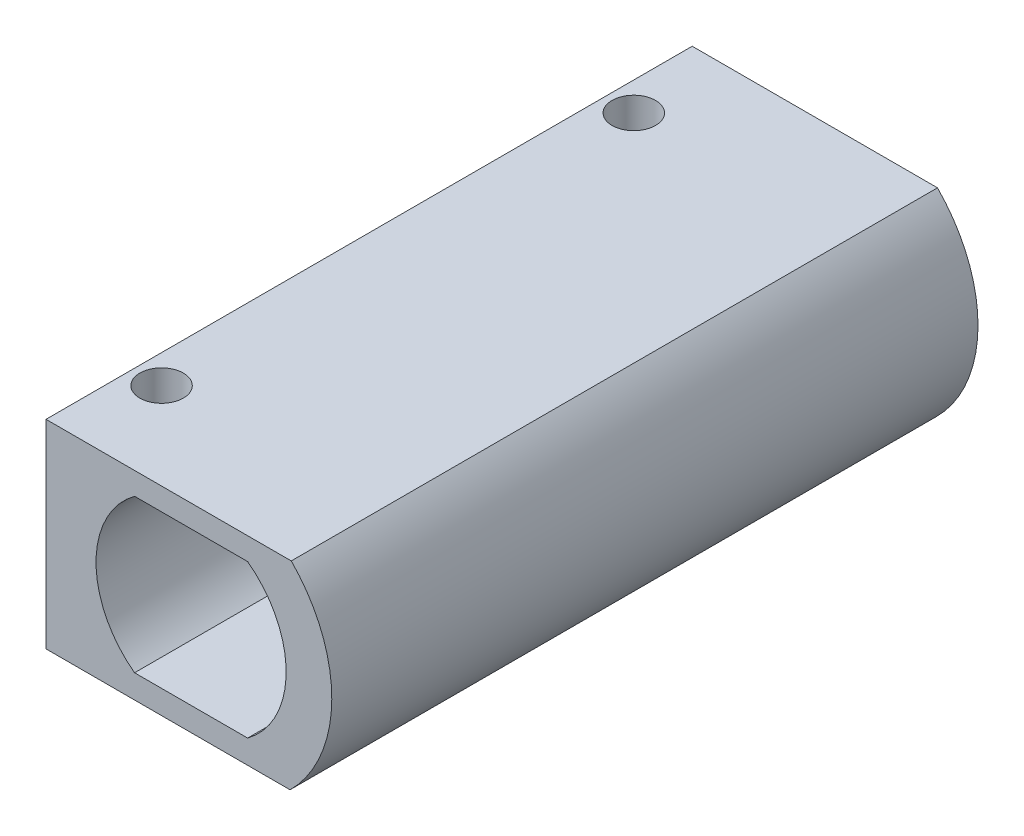
from build123d import *

# Parameters (mm, degrees)
SALIENTE_EXTRUIR1_DEPTH = 52
CROQUIS3_W              = 0.615681901
CROQUIS3_H              = 16
SALIENTE_EXTRUIR2_DEPTH = 52
CROQUIS2_R              = 1.75
CORTAR_EXTRUIR1_DEPTH   = 52
CROQUIS4_W              = 6.89100463
CROQUIS4_H              = 7.9059588
CORTAR_EXTRUIR2_DEPTH   = 10


with BuildPart() as part:
    # Croquis1 → Saliente-Extruir1 (new body)
    with BuildSketch(Plane.XY):
        with BuildLine():
            Line((-3.032251305, 15.708802589), (-22.152251305, 15.708802589))
            Line((-22.152251305, 15.708802589), (-22.152251305, -0.291197411))
            Line((-22.152251305, -0.291197411), (-3.132125677, -0.291197411))
            ThreePointArc((-3.132125677, -0.291197411), (-3.082032439, -0.241353267), (-3.032251305, -0.191197411))
            ThreePointArc((-3.032251305, -0.191197411), (0.228795467, 7.758802589), (-3.032251305, 15.708802589))
        make_face()
        with BuildLine():
            Line((-15.641976571, 13.908802589), (-6.542526038, 13.908802589))
            ThreePointArc((-6.542526038, 13.908802589), (-3.442251305, 7.758802589), (-6.542526038, 1.608802589))
            Line((-6.542526038, 1.608802589), (-15.641976571, 1.608802589))
            ThreePointArc((-15.641976571, 1.608802589), (-18.742251305, 7.758802589), (-15.641976571, 13.908802589))
        make_face(mode=Mode.SUBTRACT)
    extrude(amount=SALIENTE_EXTRUIR1_DEPTH)

    # Croquis3 → Saliente-Extruir2 (add)
    with BuildSketch(Plane.XY.offset(52)):
        with Locations((-22.460092256, 7.708802589)):
            Rectangle(CROQUIS3_W, CROQUIS3_H)
    extrude(amount=-SALIENTE_EXTRUIR2_DEPTH)

    # Croquis2 → Cortar-Extruir1 (cut)
    with BuildSketch(Plane(origin=(0, 15.708802589, 0), x_dir=(1, 0, 0), z_dir=(0, 1, 0))):
        with Locations(Location((-20.467933206, -7, 0), (0, 0, 270))):
            Circle(CROQUIS2_R)
        with Locations(Location((-20.467933206, -45, 0), (0, 0, 270))):
            Circle(CROQUIS2_R)
    extrude(amount=-CORTAR_EXTRUIR1_DEPTH, mode=Mode.SUBTRACT)

    # Croquis4 → Cortar-Extruir2 (cut)
    with BuildSketch(Plane.ZY.offset(22.767933206)):
        with Locations((26, 7.708802589)):
            Rectangle(CROQUIS4_W, CROQUIS4_H)
    extrude(amount=-CORTAR_EXTRUIR2_DEPTH, mode=Mode.SUBTRACT)


solid = part.part
